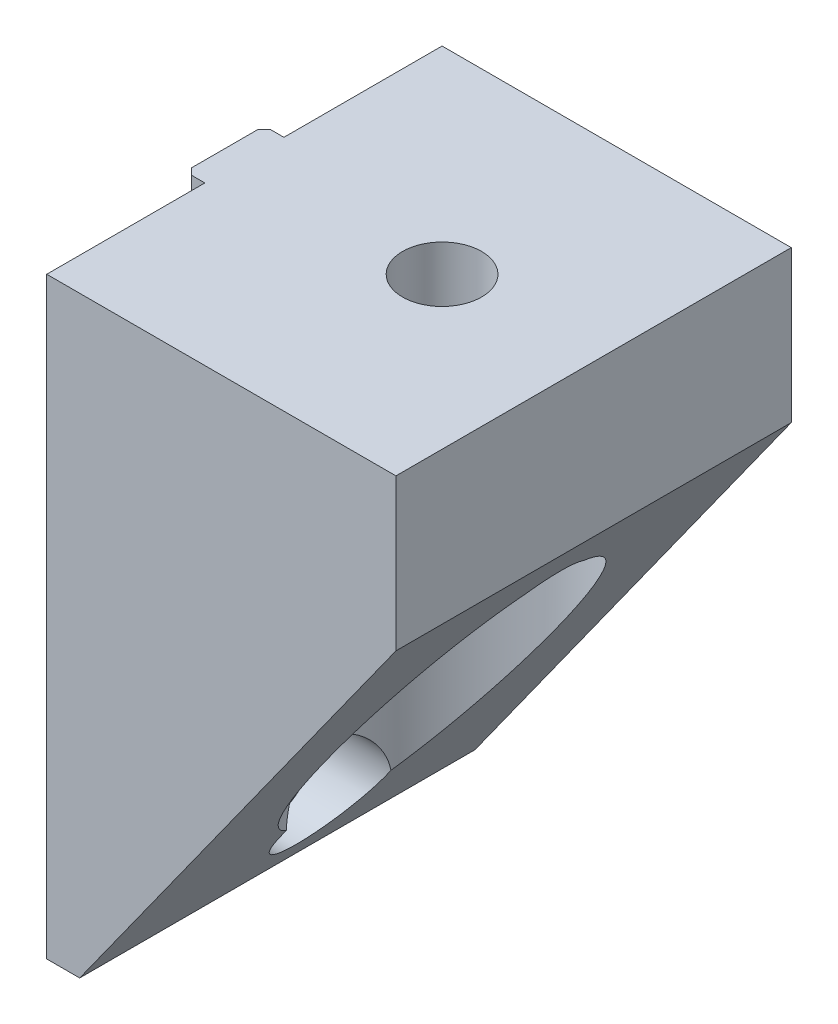
from build123d import *

# Parameters (mm, degrees)
BOSS_EXTRUDE1_DEPTH     = 60
CUT_EXTRUDE1_DEPTH      = 121.453310457
CUT_EXTRUDE1_DEPTH_BACK = 121.453310457
SKETCH2_R               = 6
SKETCH3_R               = 17.6
CUT_EXTRUDE2_DEPTH      = 78
CUT_EXTRUDE4_REACH      = 122.453
CUT_EXTRUDE4_END_RADIUS = 17.6
SKETCH5_R               = 4.1
CUT_EXTRUDE6_START      = 53
SKETCH6_R               = 8
CUT_EXTRUDE6_DEPTH      = 50
SKETCH7_W               = 12
SKETCH7_H               = 90
BOSS_EXTRUDE4_DEPTH     = 3
CUT_EXTRUDE7_DEPTH      = 121.453310457
CUT_EXTRUDE7_DEPTH_BACK = 121.453310457
SKETCH5_2_R             = 4.1
CHAMFER1_SIZE           = 1


with BuildPart() as part:
    # Sketch1 → Boss-Extrude1 (new body)
    with BuildSketch(Plane.XY):
        Polygon((0, 0), (0, 90), (53, 90), (53, 67), (5, 0), align=None)
    extrude(amount=BOSS_EXTRUDE1_DEPTH)

    # Sketch2 → Cut-Extrude1 (cut, two sides: drawn at the far end of the back side and taken through both)
    with BuildSketch(Plane(origin=(0, 0, 0), x_dir=(1, 0, 0), z_dir=(0, 1, 0)).offset(-CUT_EXTRUDE1_DEPTH_BACK)):
        with Locations(Location((30, -30, 0), (0, 0, 180))):
            Circle(SKETCH2_R)
    extrude(amount=CUT_EXTRUDE1_DEPTH + CUT_EXTRUDE1_DEPTH_BACK, mode=Mode.SUBTRACT)

    # Sketch3 → Cut-Extrude2 (cut)
    with BuildSketch(Plane(origin=(0, 0, 0), x_dir=(1, 0, 0), z_dir=(0, 1, 0))):
        with Locations(Location((30, -30, 0), (0, 0, 180))):
            Circle(SKETCH3_R)
    extrude(amount=CUT_EXTRUDE2_DEPTH, mode=Mode.SUBTRACT)

    # Cut-Extrude4: up to this cylinder (the profile starts outside it)
    cut_extrude4_end = Plane(origin=(30, 32, 30), z_dir=(0, -1, 0)) * Cylinder(CUT_EXTRUDE4_END_RADIUS, 321.106, mode=Mode.PRIVATE)
    # Sketch5 → Cut-Extrude4 (cut, up to the surface)
    with BuildSketch(Plane(origin=(0, 0, 0), x_dir=(0, 0, -1), z_dir=(1, 0, 0)), mode=Mode.PRIVATE) as cut_extrude4_sk1:
        with Locations(Location((-30, 12, 0), (0, 0, 194.678469959))):
            Circle(SKETCH5_R)
    cut_extrude4_tool1 = extrude(cut_extrude4_sk1.sketch, amount=CUT_EXTRUDE4_REACH, mode=Mode.PRIVATE) - cut_extrude4_end
    add(cut_extrude4_tool1.solids().sort_by_distance((0, 12, 30))[0], mode=Mode.SUBTRACT)
    # Sketch5 → Cut-Extrude4 (cut, up to the surface)
    with BuildSketch(Plane(origin=(0, 0, 0), x_dir=(0, 0, -1), z_dir=(1, 0, 0)), mode=Mode.PRIVATE) as cut_extrude4_sk2:
        with Locations(Location((-30, 52, 0), (0, 0, 180))):
            Circle(SKETCH5_R)
    cut_extrude4_tool2 = extrude(cut_extrude4_sk2.sketch, amount=CUT_EXTRUDE4_REACH, mode=Mode.PRIVATE) - cut_extrude4_end
    add(cut_extrude4_tool2.solids().sort_by_distance((0, 52, 30))[0], mode=Mode.SUBTRACT)

    # Sketch6 → Cut-Extrude6 (cut)
    with BuildSketch(Plane(origin=(0, 0, 0), x_dir=(0, 0, -1), z_dir=(1, 0, 0)).offset(CUT_EXTRUDE6_START)):
        with Locations((-30, 52)):
            Circle(SKETCH6_R)
        with Locations(Location((-30, 12, 0), (0, 0, 6.976713047))):
            Circle(SKETCH6_R)
    extrude(amount=-CUT_EXTRUDE6_DEPTH, mode=Mode.SUBTRACT)

    # Sketch7 → Boss-Extrude4 (add)
    with BuildSketch(Plane(origin=(0, 0, 0), x_dir=(0, 0, -1), z_dir=(1, 0, 0))):
        with Locations((-30, 45)):
            Rectangle(SKETCH7_W, SKETCH7_H)
    extrude(amount=-BOSS_EXTRUDE4_DEPTH)

    # Sketch5<2> → Cut-Extrude7 (cut, two sides: drawn at the far end of the back side and taken through both)
    with BuildSketch(Plane(origin=(0, 0, 0), x_dir=(0, 0, -1), z_dir=(1, 0, 0)).offset(-CUT_EXTRUDE7_DEPTH_BACK)):
        with Locations(Location((-30, 12, 0), (0, 0, 180))):
            Circle(SKETCH5_2_R)
        with Locations(Location((-30, 52, 0), (0, 0, 180))):
            Circle(SKETCH5_2_R)
    extrude(amount=CUT_EXTRUDE7_DEPTH + CUT_EXTRUDE7_DEPTH_BACK, mode=Mode.SUBTRACT)

    # Chamfer1
    chamfer1_edges = [part.edges().sort_by_distance(p)[0] for p in [
        (-3, 45, 36),
        (-3, 45, 24),
    ]]
    chamfer(chamfer1_edges, length=CHAMFER1_SIZE)


solid = part.part
